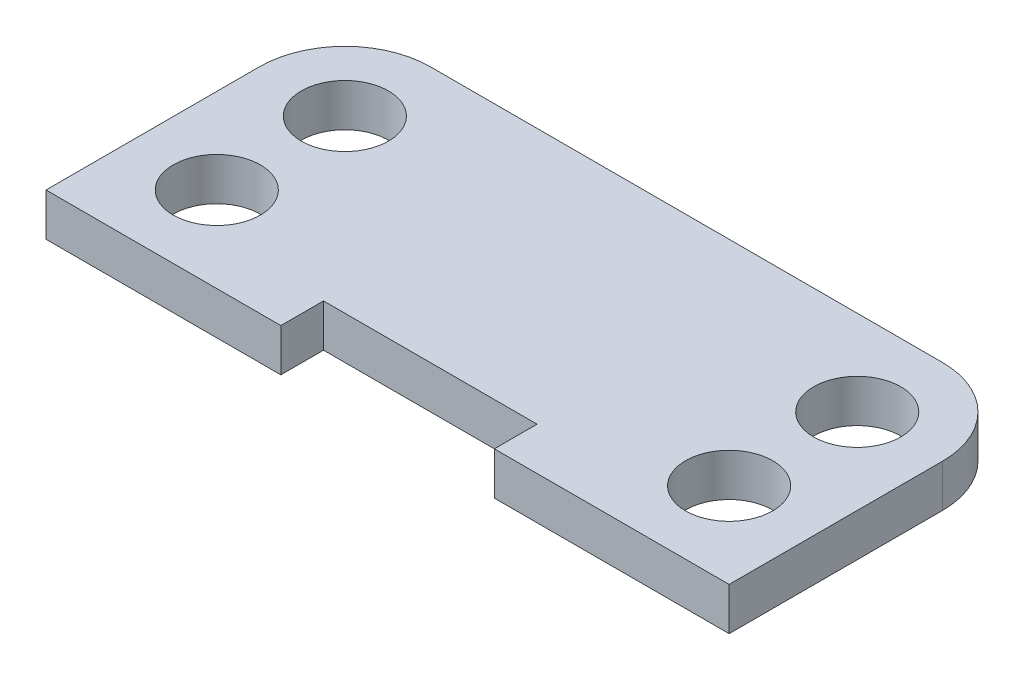
from build123d import *

# Parameters (mm, degrees)
SKETCH1_R           = 6.477
BOSS_EXTRUDE1_DEPTH = 3.175


with BuildPart() as part:
    # Sketch1 → Boss-Extrude1 (new, symmetric)
    with BuildSketch(Plane(origin=(0, 0, 0), x_dir=(1, 0, 0), z_dir=(0, 1, 0))):
        with BuildLine():
            Line((38.1, 38.1), (-38.1, 38.1))
            ThreePointArc((-38.1, 38.1), (-47.080256121, 34.380256121), (-50.8, 25.4))
            Line((-50.8, 25.4), (-50.8, -6.35))
            Line((-50.8, -6.35), (-15.875, -6.35))
            Line((-15.875, -6.35), (-15.875, 0))
            Line((-15.875, 0), (15.875, 0))
            Line((15.875, 0), (15.875, -6.35))
            Line((15.875, -6.35), (50.8, -6.35))
            Line((50.8, -6.35), (50.8, 25.4))
            ThreePointArc((50.8, 25.4), (47.080256121, 34.380256121), (38.1, 38.1))
        make_face()
        with Locations(Location((-38.1, 25.4, 0), (0, 0, 270))):
            Circle(SKETCH1_R, mode=Mode.SUBTRACT)
        with Locations(Location((-38.1, 6.35, 0), (0, 0, 270))):
            Circle(SKETCH1_R, mode=Mode.SUBTRACT)
        with Locations(Location((38.1, 25.4, 0), (0, 0, 270))):
            Circle(SKETCH1_R, mode=Mode.SUBTRACT)
        with Locations(Location((38.1, 6.35, 0), (0, 0, 270))):
            Circle(SKETCH1_R, mode=Mode.SUBTRACT)
    extrude(amount=BOSS_EXTRUDE1_DEPTH, both=True)


solid = part.part
